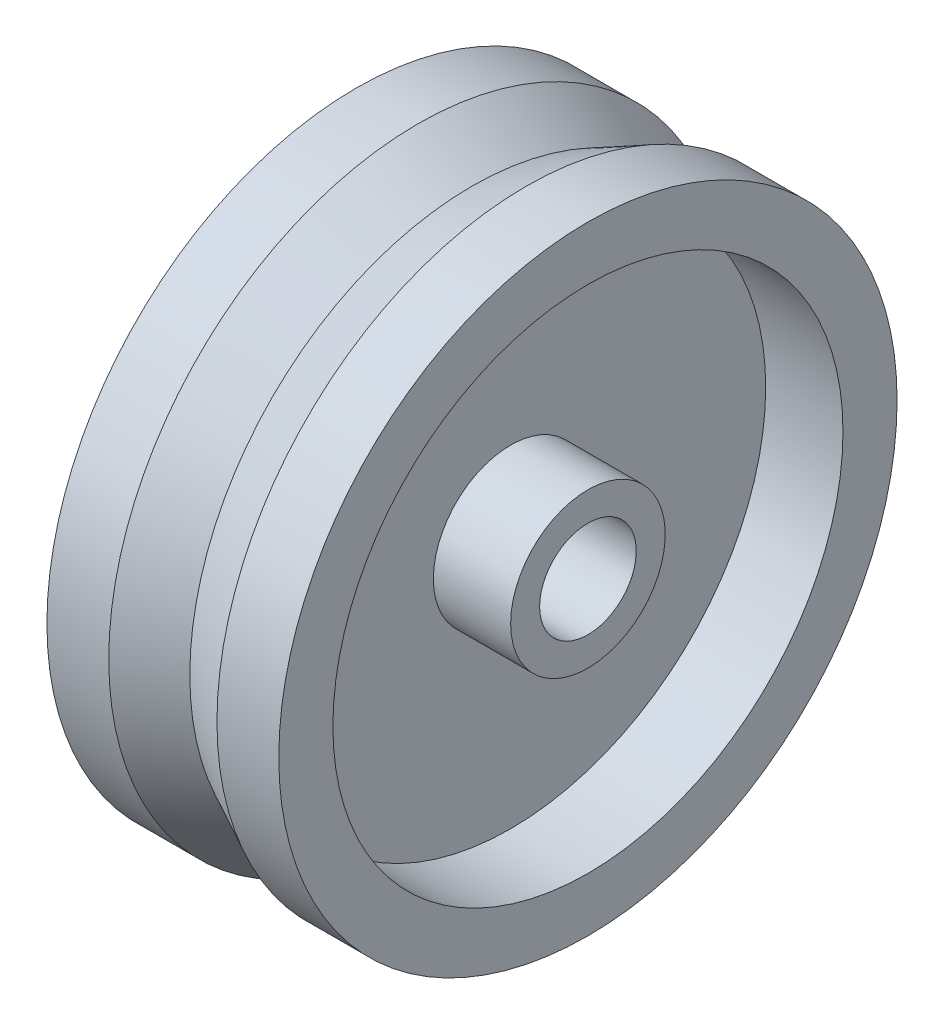
from build123d import *


with BuildPart() as part:
    # Çizim1 → Döndür1 (revolve)
    with BuildSketch(Plane.XY, mode=Mode.PRIVATE) as d_nd_r1_sk:
        Polygon((-5.608586602, 3.125), (9.391413398, 3.125), (9.391413398, 5), (4.391413398, 5), (4.391413398, 16.5), (9.391413398, 16.5), (9.391413398, 20), (5.391413398, 20), (1.891413398, 18.256578947), (-1.608586602, 20), (-5.608586602, 20), (-5.608586602, 16.5), (-0.608586602, 16.5), (-0.608586602, 5), (-5.608586602, 5), align=None)
    revolve(d_nd_r1_sk.sketch.rotate(Axis((-7.63862782, 0, 0), (1, 0, 0)), 90), axis=Axis((-7.63862782, 0, 0), (1, 0, 0)))


solid = part.part
